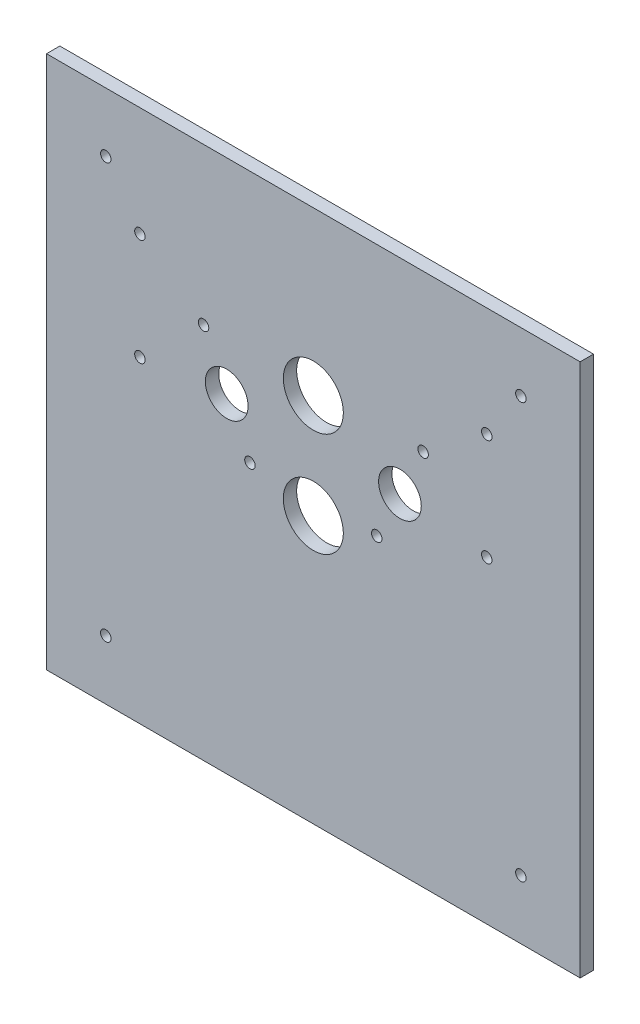
from build123d import *

# Parameters (mm, degrees)
SKETCH1_W                  = 254
SKETCH1_H                  = 254
SKETCH1_R                  = 10.16
SKETCH1_R_2                = 14.2875
BOSS_EXTRUDE2_DEPTH        = 6.35
F_9_0_196_DIAMETER_HOLE1_D = 4.9784


with BuildPart() as part:
    # Sketch1 → Boss-Extrude2 (new body)
    with BuildSketch(Plane.XY):
        Rectangle(SKETCH1_W, SKETCH1_H)
        with Locations((-41.221968309, 29.688201844)):
            Circle(SKETCH1_R, mode=Mode.SUBTRACT)
        with Locations((0, 49.5808)):
            Circle(SKETCH1_R_2, mode=Mode.SUBTRACT)
        Circle(SKETCH1_R_2, mode=Mode.SUBTRACT)
        with Locations((41.221968309, 29.688201844)):
            Circle(SKETCH1_R, mode=Mode.SUBTRACT)
    extrude(amount=BOSS_EXTRUDE2_DEPTH)

    # #9 (0.196) Diameter Hole1 (through all)
    with Locations(Plane(origin=(0, 0, 0), x_dir=(-1, 0, 0), z_dir=(0, 0, -1))):
        with Locations((-98.782817332, 98.782817332), (-52.261145976, 52.563877931), (-30.182790642, 6.812525757), (30.182790642, 6.812525757), (52.261145976, 52.563877931), (98.782817332, 98.782817332), (98.782817332, -98.782817332), (-98.782817332, -98.782817332), (-82.55, 74.9808), (-82.55, 24.1808), (82.55, 74.9808), (82.55, 24.1808)):
            Hole(F_9_0_196_DIAMETER_HOLE1_D / 2)


solid = part.part
